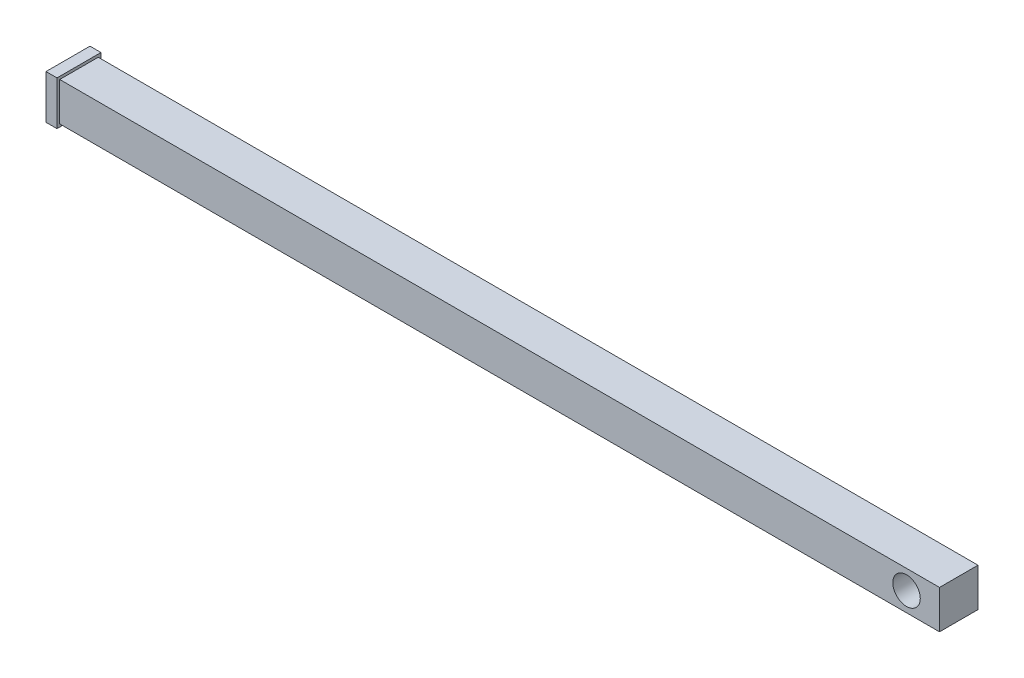
from build123d import *

# Parameters (mm, degrees)
ESQUISSE1_W             = 35
ESQUISSE1_H             = 35
BOSS_EXTRU_1_DEPTH      = 800
ESQUISSE2_W             = 40
ESQUISSE2_H             = 40
ESQUISSE2_W_2           = 35
ESQUISSE2_H_2           = 35
BOSS_EXTRU_2_DEPTH      = 10
ESQUISSE7_R             = 12.5
ENL_V_MAT_EXTRU_1_DEPTH = 25


with BuildPart() as part:
    # Esquisse1 → Boss.-Extru.1 (new body)
    with BuildSketch(Plane(origin=(0, 0, 0), x_dir=(0, 0, -1), z_dir=(1, 0, 0))):
        Rectangle(ESQUISSE1_W, ESQUISSE1_H)
    extrude(amount=BOSS_EXTRU_1_DEPTH)

    # Esquisse2 → Boss.-Extru.2 (add)
    # profile 1 of 2: a face of its own
    with BuildSketch(Plane.ZY):
        Rectangle(ESQUISSE2_W, ESQUISSE2_H)
        Rectangle(ESQUISSE2_W_2, ESQUISSE2_H_2, mode=Mode.SUBTRACT)
    # profile 2 of 2: a face of its own
    with BuildSketch(Plane.ZY):
        Rectangle(ESQUISSE2_W_2, ESQUISSE2_H_2)
    extrude(amount=BOSS_EXTRU_2_DEPTH)

    # Esquisse7 → Enlèv. mat.-Extru.1 (cut)
    with BuildSketch(Plane.XY.offset(17.5)):
        with Locations((770, 0)):
            Circle(ESQUISSE7_R)
    extrude(amount=-ENL_V_MAT_EXTRU_1_DEPTH, mode=Mode.SUBTRACT)


solid = part.part
